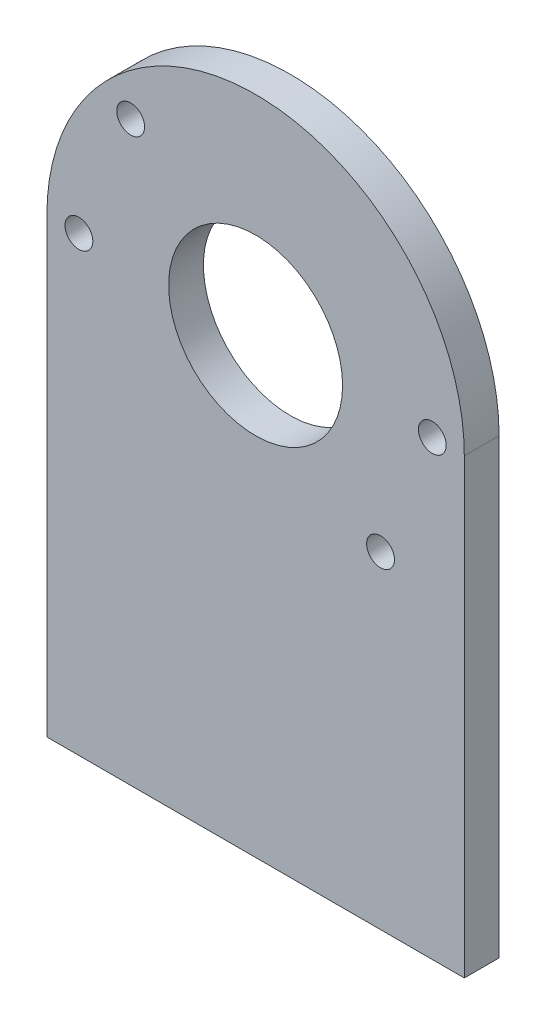
from build123d import *

# Parameters (mm, degrees)
SKETCH_1_R      = 2
SKETCH_1_R_2    = 12.5
EXTRUDE_1_DEPTH = 5


with BuildPart() as part:
    # 草图1 → 凸台-拉伸1 (new body)
    with BuildSketch(Plane.XY):
        with BuildLine():
            Line((30, -65), (-30, -65))
            Line((-30, -65), (-30, 0))
            ThreePointArc((-30, 0), (0, 30), (30, 0))
            Line((30, 0), (30, -65))
        make_face()
        with Locations((-17.96, 17.96)):
            Circle(SKETCH_1_R, mode=Mode.SUBTRACT)
        with Locations((-25.4, 0)):
            Circle(SKETCH_1_R, mode=Mode.SUBTRACT)
        with Locations(Location((25.4, 0, 0), (0, 0, 180))):
            Circle(SKETCH_1_R, mode=Mode.SUBTRACT)
        with Locations((17.96, -17.96)):
            Circle(SKETCH_1_R, mode=Mode.SUBTRACT)
        Circle(SKETCH_1_R_2, mode=Mode.SUBTRACT)
    extrude(amount=EXTRUDE_1_DEPTH)


solid = part.part
